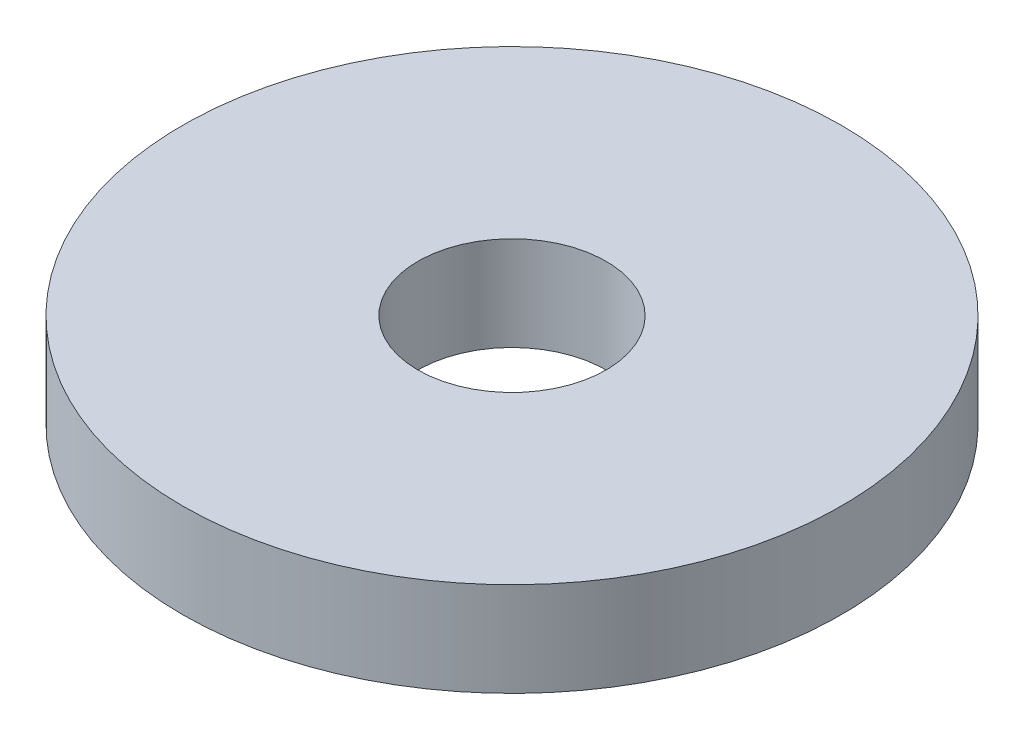
from build123d import *

# Parameters (mm, degrees)
SKETCH1_R           = 7
SKETCH1_R_2         = 2
BOSS_EXTRUDE1_DEPTH = 2


with BuildPart() as part:
    # Sketch1 → Boss-Extrude1 (new body)
    with BuildSketch(Plane(origin=(0, 0, 0), x_dir=(1, 0, 0), z_dir=(0, 1, 0))):
        with Locations(Location((0, 0, 0), (0, 0, 270))):
            Circle(SKETCH1_R)
        with Locations(Location((0, 0, 0), (0, 0, 270))):
            Circle(SKETCH1_R_2, mode=Mode.SUBTRACT)
    extrude(amount=BOSS_EXTRUDE1_DEPTH)


solid = part.part
